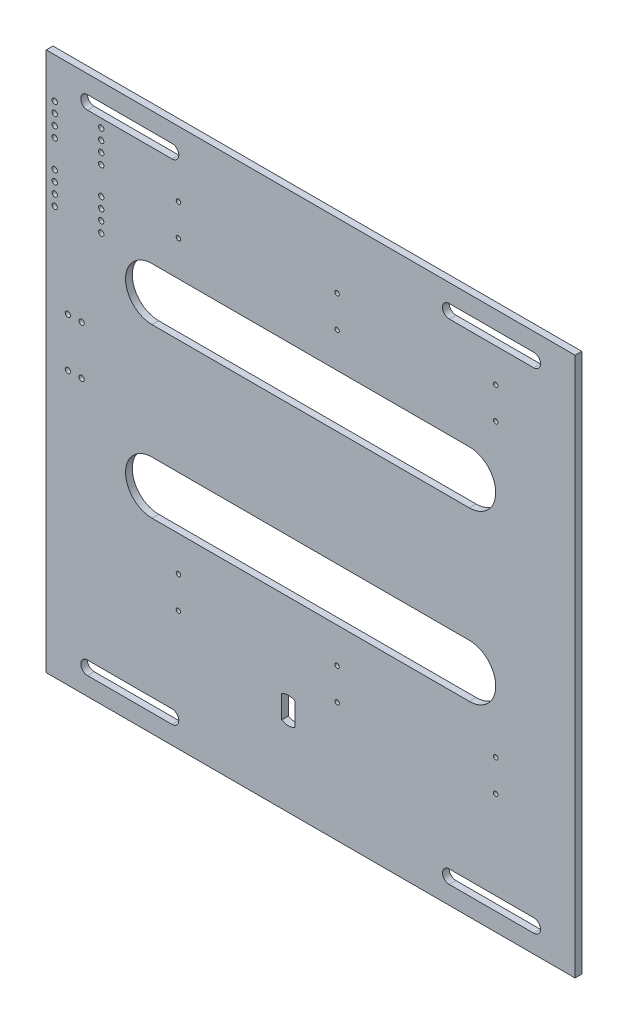
from build123d import *

# Parameters (mm, degrees)
CROQUIS1_W                         = 500
CROQUIS1_H                         = 510
SALIENTE_EXTRUIR1_DEPTH            = 6.35
CORTAR_EXTRUIR1_DEPTH              = 358.16287951
CORTAR_EXTRUIR2_DEPTH              = 358.16287951
TALADRO_ROSCADO_M6X1_01_AT_2_COUNT = 2
TALADRO_ROSCADO_M6X1_01_AT_2_PITCH = 44
TALADRO_ROSCADO_M6X1_01_AT_3_COUNT = 2
TALADRO_ROSCADO_M6X1_01_AT_3_PITCH = 71.217975259
TALADRO_ROSCADO_M6X1_01_AT_4_COUNT = 2
TALADRO_ROSCADO_M6X1_01_AT_4_PITCH = 56
MATRIZL1_COUNT                     = 4
MATRIZL1_PITCH                     = 10
TALADRO_ROSCADO_M5X0_82_D          = 4.2
TALADRO_ROSCADO_M6X1_02_D          = 5


with BuildPart() as part:
    # Croquis1 → Saliente-Extruir1 (new body)
    with BuildSketch(Plane.XY):
        Rectangle(CROQUIS1_W, CROQUIS1_H)
    extrude(amount=SALIENTE_EXTRUIR1_DEPTH)

    # Croquis2 → Cortar-Extruir1 (cut, through all)
    with BuildSketch(Plane.XY.offset(6.35)):
        with BuildLine():
            Line((-211, -225.15), (-131, -225.15))
            ThreePointArc((-131, -225.15), (-124.65, -231.5), (-131, -237.85))
            Line((-131, -237.85), (-211, -237.85))
            ThreePointArc((-211, -237.85), (-217.35, -231.5), (-211, -225.15))
        make_face()
        with BuildLine():
            Line((-211, 237.85), (-131, 237.85))
            ThreePointArc((-131, 237.85), (-124.65, 231.5), (-131, 225.15))
            Line((-131, 225.15), (-211, 225.15))
            ThreePointArc((-211, 225.15), (-217.35, 231.5), (-211, 237.85))
        make_face()
        with BuildLine():
            Line((131, 237.85), (211, 237.85))
            ThreePointArc((211, 237.85), (217.35, 231.5), (211, 225.15))
            Line((211, 225.15), (131, 225.15))
            ThreePointArc((131, 225.15), (124.65, 231.5), (131, 237.85))
        make_face()
        with BuildLine():
            Line((131, -225.15), (211, -225.15))
            ThreePointArc((211, -225.15), (217.35, -231.5), (211, -237.85))
            Line((211, -237.85), (131, -237.85))
            ThreePointArc((131, -237.85), (124.65, -231.5), (131, -225.15))
        make_face()
        with BuildLine():
            Line((-14.65, -160.73303664), (-14.65, -182.26696336))
            ThreePointArc((-14.65, -182.26696336), (-21, -184), (-27.35, -182.26696336))
            Line((-27.35, -182.26696336), (-27.35, -160.73303664))
            ThreePointArc((-27.35, -160.73303664), (-21, -159), (-14.65, -160.73303664))
        make_face()
    extrude(amount=-CORTAR_EXTRUIR1_DEPTH, mode=Mode.SUBTRACT)

    # Croquis4 → Cortar-Extruir2 (cut, through all)
    with BuildSketch(Plane.XY.offset(6.35)):
        with BuildLine():
            Line((-150, 130), (150, 130))
            ThreePointArc((150, 130), (175, 105), (150, 80))
            Line((150, 80), (-150, 80))
            ThreePointArc((-150, 80), (-175, 105), (-150, 130))
        make_face()
        with BuildLine():
            Line((-150, -28.46), (150, -28.46))
            ThreePointArc((150, -28.46), (175, -53.46), (150, -78.46))
            Line((150, -78.46), (-150, -78.46))
            ThreePointArc((-150, -78.46), (-175, -53.46), (-150, -28.46))
        make_face()
    extrude(amount=-CORTAR_EXTRUIR2_DEPTH, mode=Mode.SUBTRACT)

    # Croquis7 → Taladro roscado M6x1.01 (revolve, cut)
    with BuildSketch(Plane(origin=(-242, 217, 6.35), x_dir=(0, -1, 0), z_dir=(1, 0, 0))):
        Polygon((0, 0), (0, 18.502151548), (2.5, 17), (2.5, 0), align=None)
    taladro_roscado_m6x1_01 = revolve(axis=Axis((-242, 217, 12.7), (0, 0, -1)), mode=Mode.SUBTRACT)

    # Taladro roscado M6x1.01 at 2: Taladro roscado M6x1.01 ×2
    with Locations(*[(i * TALADRO_ROSCADO_M6X1_01_AT_2_PITCH, 0, 0) for i in range(1, TALADRO_ROSCADO_M6X1_01_AT_2_COUNT)]):
        add(taladro_roscado_m6x1_01, mode=Mode.SUBTRACT)

    # Taladro roscado M6x1.01 at 3: Taladro roscado M6x1.01 ×2
    with Locations(*[Vector(0.6178215519319036, -0.7863183388224226, 0) * (i * TALADRO_ROSCADO_M6X1_01_AT_3_PITCH) for i in range(1, TALADRO_ROSCADO_M6X1_01_AT_3_COUNT)]):
        add(taladro_roscado_m6x1_01, mode=Mode.SUBTRACT)

    # Taladro roscado M6x1.01 at 4: Taladro roscado M6x1.01 ×2
    with Locations(*[(0, -i * TALADRO_ROSCADO_M6X1_01_AT_4_PITCH, 0) for i in range(1, TALADRO_ROSCADO_M6X1_01_AT_4_COUNT)]):
        add(taladro_roscado_m6x1_01, mode=Mode.SUBTRACT)

    # MatrizL1: Taladro roscado M6x1.01 ×4
    with Locations(*[(0, -i * MATRIZL1_PITCH, 0) for i in range(1, MATRIZL1_COUNT)]):
        add(taladro_roscado_m6x1_01, mode=Mode.SUBTRACT)

    # MatrizL1 copy 1 sketch → MatrizL1 copy 1 (revolve, cut)
    with BuildSketch(Plane(origin=(-198, 207, 6.35), x_dir=(0, -1, 0), z_dir=(1, 0, 0))):
        Polygon((0, 0), (0, 18.502151548), (2.5, 17), (2.5, 0), align=None)
    revolve(axis=Axis((-198, 207, 12.7), (0, 0, -1)), mode=Mode.SUBTRACT)

    # MatrizL1 copy 2 sketch → MatrizL1 copy 2 (revolve, cut)
    with BuildSketch(Plane(origin=(-198, 197, 6.35), x_dir=(0, -1, 0), z_dir=(1, 0, 0))):
        Polygon((0, 0), (0, 18.502151548), (2.5, 17), (2.5, 0), align=None)
    revolve(axis=Axis((-198, 197, 12.7), (0, 0, -1)), mode=Mode.SUBTRACT)

    # MatrizL1 copy 3 sketch → MatrizL1 copy 3 (revolve, cut)
    with BuildSketch(Plane(origin=(-198, 187, 6.35), x_dir=(0, -1, 0), z_dir=(1, 0, 0))):
        Polygon((0, 0), (0, 18.502151548), (2.5, 17), (2.5, 0), align=None)
    revolve(axis=Axis((-198, 187, 12.7), (0, 0, -1)), mode=Mode.SUBTRACT)

    # MatrizL1 copy 4 sketch → MatrizL1 copy 4 (revolve, cut)
    with BuildSketch(Plane(origin=(-198, 151, 6.35), x_dir=(0, -1, 0), z_dir=(1, 0, 0))):
        Polygon((0, 0), (0, 18.502151548), (2.5, 17), (2.5, 0), align=None)
    revolve(axis=Axis((-198, 151, 12.7), (0, 0, -1)), mode=Mode.SUBTRACT)

    # MatrizL1 copy 5 sketch → MatrizL1 copy 5 (revolve, cut)
    with BuildSketch(Plane(origin=(-198, 141, 6.35), x_dir=(0, -1, 0), z_dir=(1, 0, 0))):
        Polygon((0, 0), (0, 18.502151548), (2.5, 17), (2.5, 0), align=None)
    revolve(axis=Axis((-198, 141, 12.7), (0, 0, -1)), mode=Mode.SUBTRACT)

    # MatrizL1 copy 6 sketch → MatrizL1 copy 6 (revolve, cut)
    with BuildSketch(Plane(origin=(-198, 131, 6.35), x_dir=(0, -1, 0), z_dir=(1, 0, 0))):
        Polygon((0, 0), (0, 18.502151548), (2.5, 17), (2.5, 0), align=None)
    revolve(axis=Axis((-198, 131, 12.7), (0, 0, -1)), mode=Mode.SUBTRACT)

    # MatrizL1 copy 7 sketch → MatrizL1 copy 7 (revolve, cut)
    with BuildSketch(Plane(origin=(-242, 151, 6.35), x_dir=(0, -1, 0), z_dir=(1, 0, 0))):
        Polygon((0, 0), (0, 18.502151548), (2.5, 17), (2.5, 0), align=None)
    revolve(axis=Axis((-242, 151, 12.7), (0, 0, -1)), mode=Mode.SUBTRACT)

    # MatrizL1 copy 8 sketch → MatrizL1 copy 8 (revolve, cut)
    with BuildSketch(Plane(origin=(-242, 141, 6.35), x_dir=(0, -1, 0), z_dir=(1, 0, 0))):
        Polygon((0, 0), (0, 18.502151548), (2.5, 17), (2.5, 0), align=None)
    revolve(axis=Axis((-242, 141, 12.7), (0, 0, -1)), mode=Mode.SUBTRACT)

    # MatrizL1 copy 9 sketch → MatrizL1 copy 9 (revolve, cut)
    with BuildSketch(Plane(origin=(-242, 131, 6.35), x_dir=(0, -1, 0), z_dir=(1, 0, 0))):
        Polygon((0, 0), (0, 18.502151548), (2.5, 17), (2.5, 0), align=None)
    revolve(axis=Axis((-242, 131, 12.7), (0, 0, -1)), mode=Mode.SUBTRACT)

    # Taladro roscado M5x0.82 (through all)
    with Locations(Plane.XY.offset(6.35)):
        with Locations((-125, 193.27), (-125, 163.27), (25, 193.27), (25, 163.27), (175, 193.27), (175, 163.27), (175, -111.73), (175, -141.73), (25, -111.73), (25, -141.73), (-125, -111.73), (-125, -141.73)):
            Hole(TALADRO_ROSCADO_M5X0_82_D / 2)

    # Taladro roscado M6x1.02 (through all)
    with Locations(Plane.XY.offset(6.35)):
        with Locations((-229.542734314, 48.77), (-216.542734314, 48.77), (-216.542734314, 2.77), (-229.542734314, 2.77)):
            Hole(TALADRO_ROSCADO_M6X1_02_D / 2)


solid = part.part
